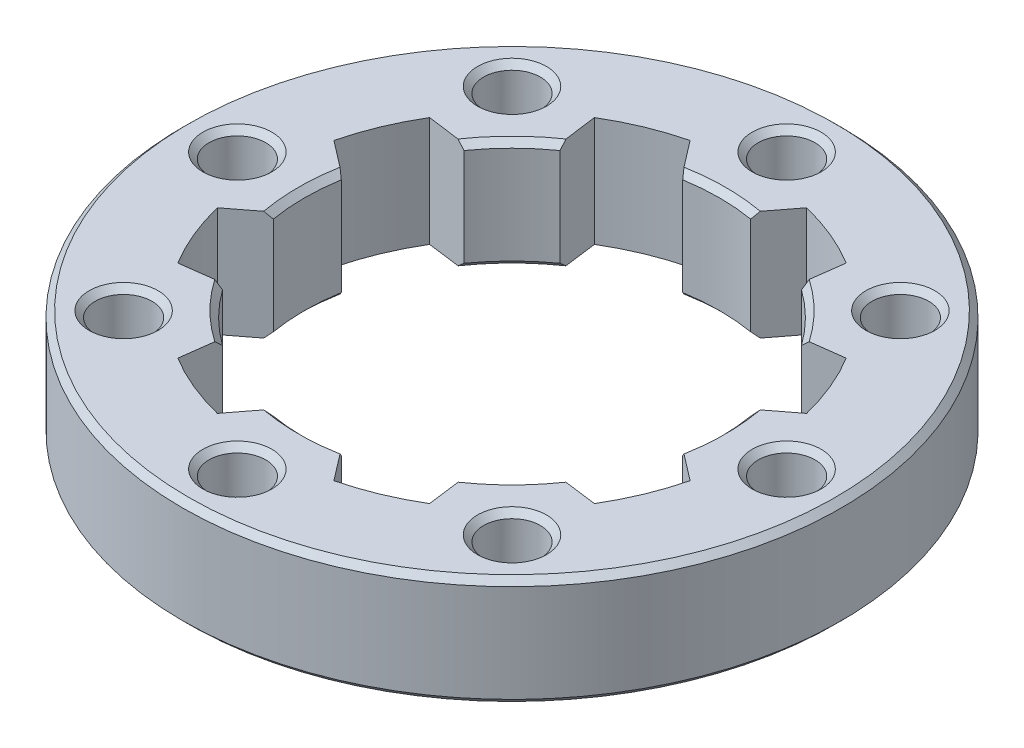
from build123d import *

# Parameters (mm, degrees)
ESBO_O1_W             = 20
ESBO_O1_H             = 18
ESBO_O2_R             = 4.65
CORTE_EXTRUS_O1_DEPTH = 79.460180984
CHANFRO2_SIZE         = 1
CORTE_EXTRUS_O2_DEPTH = 79.460180984
CHANFRO3_SIZE         = 1
CHANFRO4_SIZE         = 1


with BuildPart() as part:
    # Esboço1 → Revolução1 (revolve)
    with BuildSketch(Plane.XY, mode=Mode.PRIVATE) as revolu_o1_sk:
        with Locations((44, 9)):
            Rectangle(ESBO_O1_W, ESBO_O1_H)
    revolve(revolu_o1_sk.sketch.rotate(Axis((0, -47.005255255, 0), (0, 1, 0)), 90), axis=Axis((0, -47.005255255, 0), (0, 1, 0)))

    # Esboço2 → Corte-extrusão1 (cut, through all)
    with BuildSketch(Plane(origin=(0, 18, 0), x_dir=(1, 0, 0), z_dir=(0, 1, 0))):
        with Locations(Location((-45, 0, 0), (0, 0, 270))):
            Circle(ESBO_O2_R)
        with Locations(Location((-31.819805153, 31.819805153, 0), (0, 0, 270))):
            Circle(ESBO_O2_R)
        with Locations(Location((0, 45, 0), (0, 0, 270))):
            Circle(ESBO_O2_R)
        with Locations(Location((31.819805153, 31.819805153, 0), (0, 0, 270))):
            Circle(ESBO_O2_R)
        with Locations(Location((45, 0, 0), (0, 0, 270))):
            Circle(ESBO_O2_R)
        with Locations(Location((31.819805153, -31.819805153, 0), (0, 0, 270))):
            Circle(ESBO_O2_R)
        with Locations(Location((0, -45, 0), (0, 0, 270))):
            Circle(ESBO_O2_R)
        with Locations(Location((-31.819805153, -31.819805153, 0), (0, 0, 270))):
            Circle(ESBO_O2_R)
    extrude(amount=-CORTE_EXTRUS_O1_DEPTH, mode=Mode.SUBTRACT)

    # Chanfro2
    chanfro2_edges = [part.edges().sort_by_distance(p)[0] for p in [
        (-45, 0, -4.65),
        (-45, 18, -4.65),
        (-31.819805153, 0, -36.469805153),
        (-31.819805153, 18, -36.469805153),
        (0, 0, -49.65),
        (0, 18, -49.65),
        (31.819805153, 0, -36.469805153),
        (31.819805153, 18, -36.469805153),
        (45, 0, -4.65),
        (45, 18, -4.65),
        (31.819805153, 0, 27.169805153),
        (31.819805153, 18, 27.169805153),
        (0, 0, 40.35),
        (0, 18, 40.35),
        (0, 0, 54),
        (-31.819805153, 0, 27.169805153),
        (-31.819805153, 18, 27.169805153),
        (0, 18, 54),
    ]]
    chamfer(chanfro2_edges, length=CHANFRO2_SIZE)

    # Esboço3 → Corte-extrusão2 (cut, through all)
    with BuildSketch(Plane(origin=(0, 18, 0), x_dir=(1, 0, 0), z_dir=(0, 1, 0))):
        with BuildLine():
            Line((9.547939213, 38.72951992), (5.261602172, 33.143456731))
            Line((5.261602172, 33.143456731), (19.715448431, 27.156477582))
            Line((19.715448431, 27.156477582), (20.634493603, 34.137318732))
            ThreePointArc((20.634493603, 34.137318732), (15.264890783, 36.852706357), (9.547939213, 38.72951992))
        make_face()
        with BuildLine():
            Line((27.156477582, 19.715448431), (33.143456731, 5.261602172))
            Line((33.143456731, 5.261602172), (38.72951992, 9.547939213))
            ThreePointArc((38.72951992, 9.547939213), (36.852706357, 15.264890783), (34.137318732, 20.634493603))
            Line((34.137318732, 20.634493603), (27.156477582, 19.715448431))
        make_face()
        with BuildLine():
            Line((33.143456731, -5.261602172), (27.156477582, -19.715448431))
            Line((27.156477582, -19.715448431), (34.137318732, -20.634493603))
            ThreePointArc((34.137318732, -20.634493603), (36.852706357, -15.264890783), (38.72951992, -9.547939213))
            Line((38.72951992, -9.547939213), (33.143456731, -5.261602172))
        make_face()
        with BuildLine():
            Line((19.715448431, -27.156477582), (5.261602172, -33.143456731))
            Line((5.261602172, -33.143456731), (9.547939213, -38.72951992))
            ThreePointArc((9.547939213, -38.72951992), (15.264890783, -36.852706357), (20.634493603, -34.137318732))
            Line((20.634493603, -34.137318732), (19.715448431, -27.156477582))
        make_face()
        with BuildLine():
            Line((-5.261602172, -33.143456731), (-19.715448431, -27.156477582))
            Line((-19.715448431, -27.156477582), (-20.634493603, -34.137318732))
            ThreePointArc((-20.634493603, -34.137318732), (-15.264890783, -36.852706357), (-9.547939213, -38.72951992))
            Line((-9.547939213, -38.72951992), (-5.261602172, -33.143456731))
        make_face()
        with BuildLine():
            Line((-27.156477582, -19.715448431), (-33.143456731, -5.261602172))
            Line((-33.143456731, -5.261602172), (-38.72951992, -9.547939213))
            ThreePointArc((-38.72951992, -9.547939213), (-36.852706357, -15.264890783), (-34.137318732, -20.634493603))
            Line((-34.137318732, -20.634493603), (-27.156477582, -19.715448431))
        make_face()
        with BuildLine():
            Line((-33.143456731, 5.261602172), (-27.156477582, 19.715448431))
            Line((-27.156477582, 19.715448431), (-34.137318732, 20.634493603))
            ThreePointArc((-34.137318732, 20.634493603), (-36.852706357, 15.264890783), (-38.72951992, 9.547939213))
            Line((-38.72951992, 9.547939213), (-33.143456731, 5.261602172))
        make_face()
        with BuildLine():
            Line((-19.715448431, 27.156477582), (-5.261602172, 33.143456731))
            Line((-5.261602172, 33.143456731), (-9.547939213, 38.72951992))
            ThreePointArc((-9.547939213, 38.72951992), (-15.264890783, 36.852706357), (-20.634493603, 34.137318732))
            Line((-20.634493603, 34.137318732), (-19.715448431, 27.156477582))
        make_face()
    extrude(amount=-CORTE_EXTRUS_O2_DEPTH, mode=Mode.SUBTRACT)

    # Chanfro3
    chanfro3_edges = [part.edges().sort_by_distance(p)[0] for p in [
        (0, 0, -34),
        (0, 18, -34),
        (24.04163056, 0, -24.04163056),
        (24.04163056, 18, -24.04163056),
        (34, 18, 0),
        (24.04163056, 18, 24.04163056),
        (0, 18, 34),
        (-24.04163056, 18, 24.04163056),
        (-34, 0, 0),
        (-34, 18, 0),
        (-24.04163056, 0, -24.04163056),
        (-24.04163056, 18, -24.04163056),
    ]]
    chamfer(chanfro3_edges, length=CHANFRO3_SIZE)

    # Chanfro4
    chanfro4_edges = [part.edges().sort_by_distance(p)[0] for p in [
        (34, 0, 0),
        (24.04163056, 0, 24.04163056),
        (0, 0, 34),
        (-24.04163056, 0, 24.04163056),
    ]]
    chamfer(chanfro4_edges, length=CHANFRO4_SIZE)


solid = part.part
